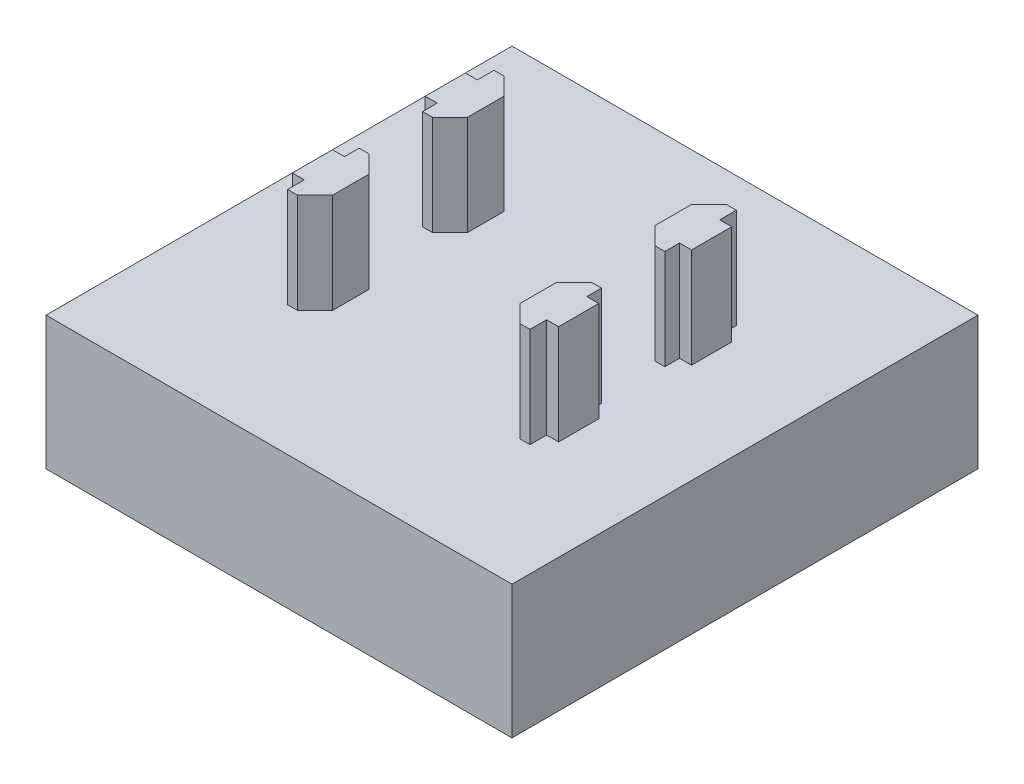
from build123d import *

# Parameters (mm, degrees)
SKETCH1_W           = 70
SKETCH1_H           = 70
BOSS_EXTRUDE1_DEPTH = 20
BOSS_EXTRUDE3_DEPTH = 15


with BuildPart() as part:
    # Sketch1 → Boss-Extrude1 (new body)
    with BuildSketch(Plane(origin=(0, 0, 0), x_dir=(1, 0, 0), z_dir=(0, 1, 0))):
        with Locations((-35, -35)):
            Rectangle(SKETCH1_W, SKETCH1_H)
    extrude(amount=BOSS_EXTRUDE1_DEPTH)

    # Sketch2 → Boss-Extrude3 (add)
    with BuildSketch(Plane(origin=(0, 20, 0), x_dir=(1, 0, 0), z_dir=(0, 1, 0))):
        Polygon((-55, -22), (-53.2, -22), (-53.2, -19.5), (-51.7, -19.5), (-49.08370491, -22.11629509), (-49.08370491, -27.61629509), (-51.7, -30.232590181), (-53.2, -30.232590181), (-53.2, -28.032590181), (-55, -28.032590181), align=None)
        Polygon((-16.8, -28.032590181), (-15, -28.032590181), (-15, -22), (-16.8, -22), (-16.8, -19.5), (-18.3, -19.5), (-20.91629509, -22.11629509), (-20.91629509, -27.61629509), (-18.3, -30.232590181), (-16.8, -30.232590181), align=None)
        Polygon((-53.2, -41.967409819), (-55, -41.967409819), (-55, -48), (-53.2, -48), (-53.2, -50.5), (-51.7, -50.5), (-49.08370491, -47.88370491), (-49.08370491, -42.38370491), (-51.7, -39.767409819), (-53.2, -39.767409819), align=None)
        Polygon((-16.8, -39.767409819), (-16.8, -41.967409819), (-15, -41.967409819), (-15, -48), (-16.8, -48), (-16.8, -50.5), (-18.3, -50.5), (-20.91629509, -47.88370491), (-20.91629509, -42.38370491), (-18.3, -39.767409819), align=None)
    extrude(amount=BOSS_EXTRUDE3_DEPTH)


solid = part.part
